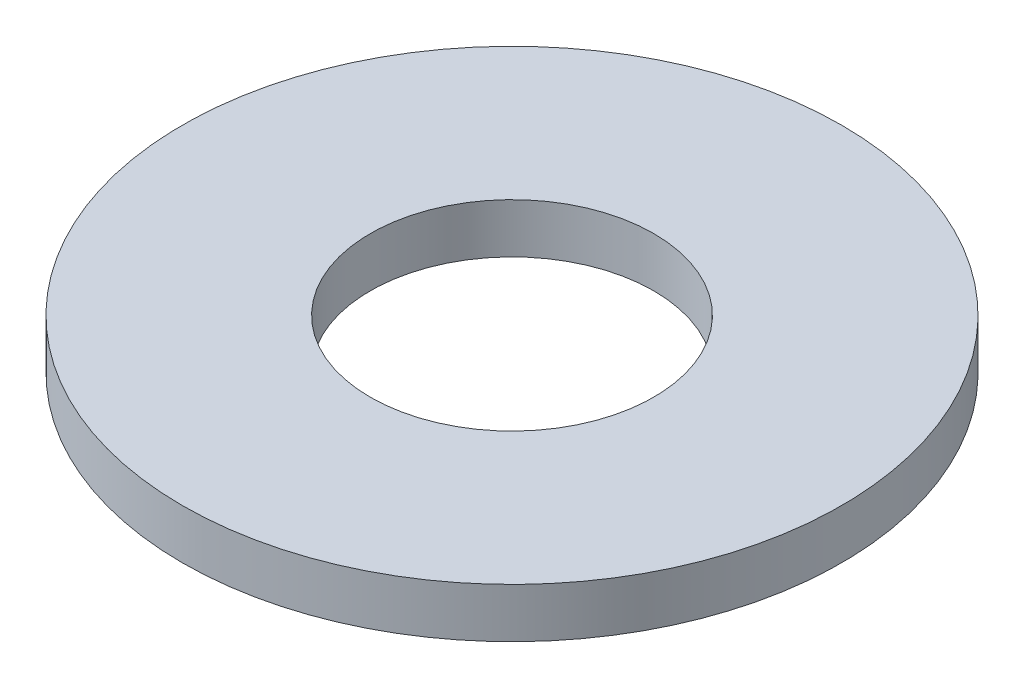
from build123d import *

# Parameters (mm, degrees)
SKETCH1_R           = 9.3
SKETCH1_R_2         = 4
BOSS_EXTRUDE1_DEPTH = 1.4


with BuildPart() as part:
    # Sketch1 → Boss-Extrude1 (new body)
    with BuildSketch(Plane(origin=(0, 0, 0), x_dir=(1, 0, 0), z_dir=(0, 1, 0))):
        with Locations(Location((0, 0, 0), (0, 0, 270))):
            Circle(SKETCH1_R)
        with Locations(Location((0, 0, 0), (0, 0, 270))):
            Circle(SKETCH1_R_2, mode=Mode.SUBTRACT)
    extrude(amount=BOSS_EXTRUDE1_DEPTH)


solid = part.part
